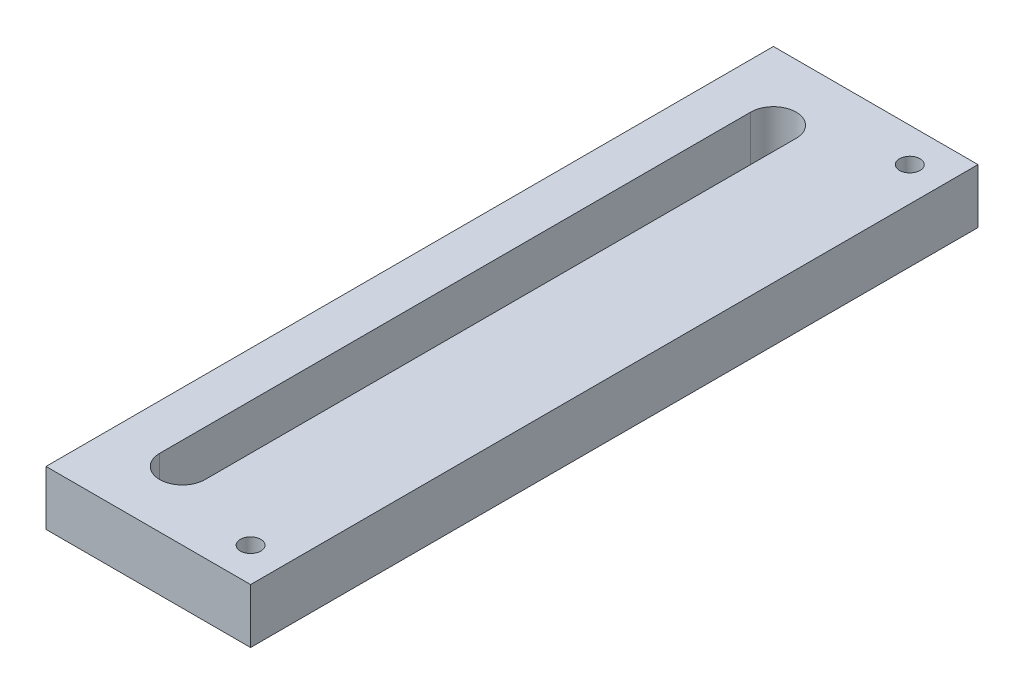
from build123d import *

# Parameters (mm, degrees)
SKETCH2_W           = 45
SKETCH2_H           = 160
BOSS_EXTRUDE3_DEPTH = 12
SKETCH3_R           = 2.25
CUT_EXTRUDE3_DEPTH  = 5
SKETCH5_R           = 5
CUT_EXTRUDE5_DEPTH  = 7
CUT_EXTRUDE6_DEPTH  = 84.965766834


with BuildPart() as part:
    # Sketch2 → Boss-Extrude3 (new body)
    with BuildSketch(Plane(origin=(0, 0, 0), x_dir=(1, 0, 0), z_dir=(0, 1, 0))):
        Rectangle(SKETCH2_W, SKETCH2_H)
    extrude(amount=BOSS_EXTRUDE3_DEPTH)

    # Sketch3 → Cut-Extrude3 (cut)
    with BuildSketch(Plane(origin=(0, 12, 0), x_dir=(1, 0, 0), z_dir=(0, 1, 0))):
        with Locations(Location((15, 72.5, 0), (0, 0, 270))):
            Circle(SKETCH3_R)
        with Locations(Location((15, -72.5, 0), (0, 0, 270))):
            Circle(SKETCH3_R)
    cut_extrude3 = extrude(amount=-CUT_EXTRUDE3_DEPTH, mode=Mode.SUBTRACT)

    # Sketch5 → Cut-Extrude5 (cut)
    with BuildSketch(Plane(origin=(0, 7, 0), x_dir=(1, 0, 0), z_dir=(0, 1, 0))):
        with Locations(Location((15, 72.5, 0), (0, 0, 270))):
            Circle(SKETCH5_R)
    cut_extrude5 = extrude(amount=-CUT_EXTRUDE5_DEPTH, mode=Mode.SUBTRACT)

    # Mirror1: Cut-Extrude3, Cut-Extrude5 across plane
    add(cut_extrude3.mirror(Plane.XY), mode=Mode.SUBTRACT)
    add(cut_extrude5.mirror(Plane.XY), mode=Mode.SUBTRACT)

    # Sketch6 → Cut-Extrude6 (cut, through all)
    with BuildSketch(Plane(origin=(0, 12, 0), x_dir=(1, 0, 0), z_dir=(0, 1, 0))):
        with BuildLine():
            Line((-12.5, -65), (-12.5, 65))
            ThreePointArc((-12.5, 65), (-7.5, 70), (-2.5, 65))
            Line((-2.5, 65), (-2.5, -65))
            ThreePointArc((-2.5, -65), (-7.5, -70), (-12.5, -65))
        make_face()
    extrude(amount=-CUT_EXTRUDE6_DEPTH, mode=Mode.SUBTRACT)


solid = part.part
